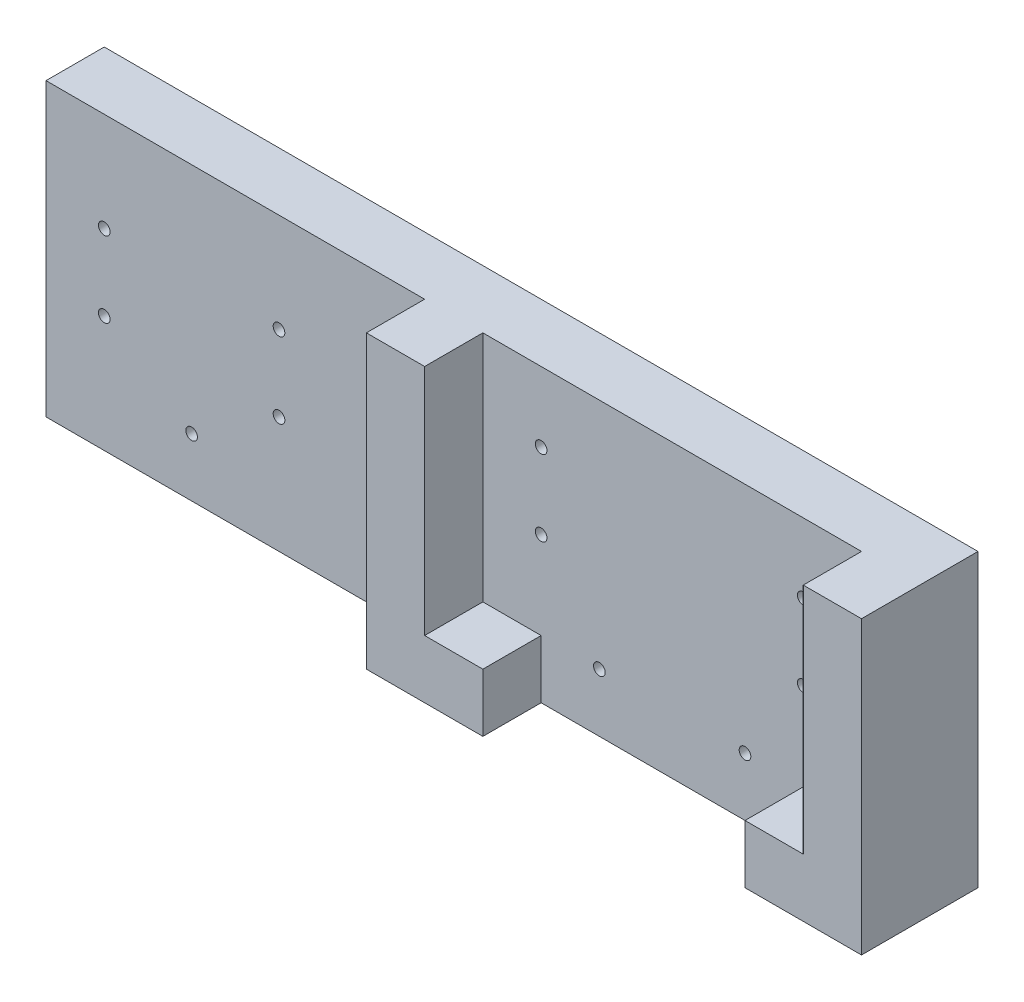
from build123d import *

# Parameters (mm, degrees)
ESQUISSE1_W        = 150
ESQUISSE1_H        = 50
ESQUISSE1_R        = 1
BOSS_EXTRU_1_DEPTH = 10
BOSS_EXTRU_2_DEPTH = 10


with BuildPart() as part:
    # Esquisse1 → Boss.-Extru.1 (new body)
    with BuildSketch(Plane(origin=(0, 0, -20), x_dir=(-1, 0, 0), z_dir=(0, 0, -1))):
        with Locations((11.141434162, 34.535821702)):
            Rectangle(ESQUISSE1_W, ESQUISSE1_H)
        with Locations((-43.858565838, 47.535821702)):
            Circle(ESQUISSE1_R, mode=Mode.SUBTRACT)
        with Locations((-43.858565838, 34.535821702)):
            Circle(ESQUISSE1_R, mode=Mode.SUBTRACT)
        with Locations((1.141434162, 34.535821702)):
            Circle(ESQUISSE1_R, mode=Mode.SUBTRACT)
        with Locations((1.141434162, 47.535821702)):
            Circle(ESQUISSE1_R, mode=Mode.SUBTRACT)
        with Locations((-8.858565838, 19.535821702)):
            Circle(ESQUISSE1_R, mode=Mode.SUBTRACT)
        with Locations((-33.858565838, 19.535821702)):
            Circle(ESQUISSE1_R, mode=Mode.SUBTRACT)
        with Locations((76.141434162, 29.535821702)):
            Circle(ESQUISSE1_R, mode=Mode.SUBTRACT)
        with Locations((76.141434162, 42.535821702)):
            Circle(ESQUISSE1_R, mode=Mode.SUBTRACT)
        with Locations((46.141434162, 42.535821702)):
            Circle(ESQUISSE1_R, mode=Mode.SUBTRACT)
        with Locations((46.141434162, 29.535821702)):
            Circle(ESQUISSE1_R, mode=Mode.SUBTRACT)
        with Locations((61.141434162, 19.535821702)):
            Circle(ESQUISSE1_R, mode=Mode.SUBTRACT)
    extrude(amount=BOSS_EXTRU_1_DEPTH)

    # Esquisse2 → Boss.-Extru.2 (add)
    with BuildSketch(Plane.XY.offset(-20)):
        Polygon((-21.141434162, 59.535821702), (-21.141434162, 9.535821702), (-1.141434162, 9.535821702), (-1.141434162, 19.535821702), (-11.141434162, 19.535821702), (-11.141434162, 59.535821702), align=None)
        Polygon((43.858565838, 19.535821702), (43.858565838, 9.535821702), (63.858565838, 9.535821702), (63.858565838, 59.535821702), (53.858565838, 59.535821702), (53.858565838, 19.535821702), align=None)
    extrude(amount=BOSS_EXTRU_2_DEPTH)


solid = part.part
